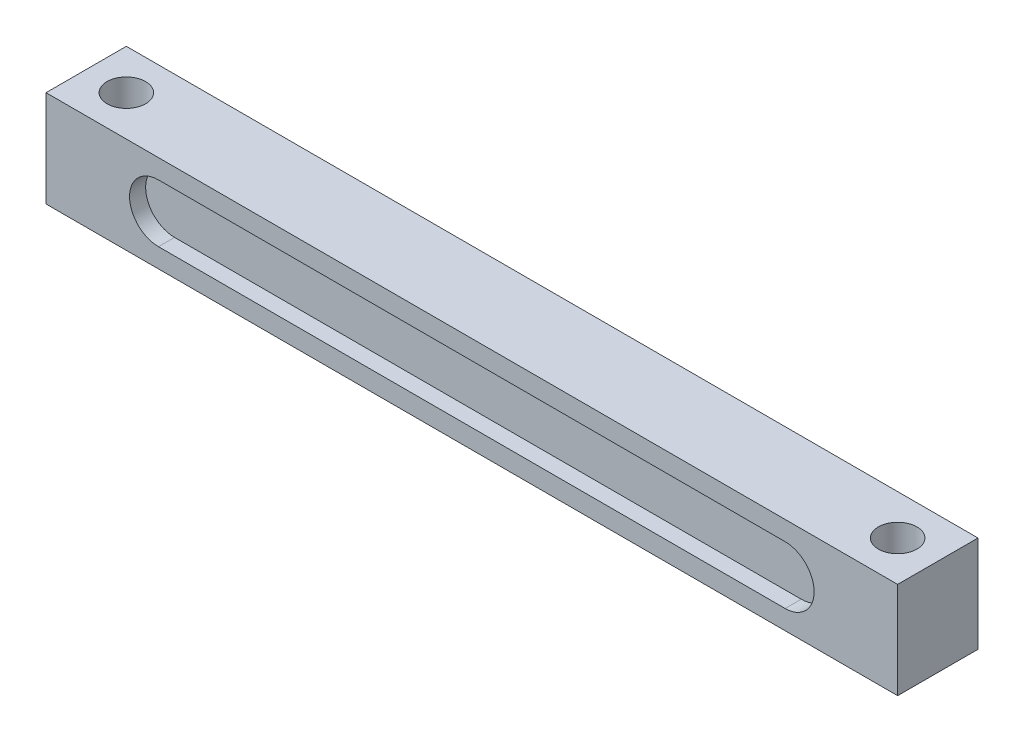
from build123d import *

# Parameters (mm, degrees)
SKETCH1_W           = 336.55
SKETCH1_H           = 31.75
SKETCH1_R           = 7.62
BOSS_EXTRUDE1_DEPTH = 38.1
CUT_EXTRUDE1_DEPTH  = 6.35
CUT_EXTRUDE3_START  = -6.35
CUT_EXTRUDE3_DEPTH  = 6.35


with BuildPart() as part:
    # Sketch1 → Boss-Extrude1 (new body)
    with BuildSketch(Plane(origin=(0, 0, 0), x_dir=(1, 0, 0), z_dir=(0, 1, 0))):
        with Locations((168.275, 15.875)):
            Rectangle(SKETCH1_W, SKETCH1_H)
        with Locations(Location((15.875, 15.875, 0), (0, 0, 90))):
            Circle(SKETCH1_R, mode=Mode.SUBTRACT)
        with Locations(Location((320.675, 15.875, 0), (0, 0, 90))):
            Circle(SKETCH1_R, mode=Mode.SUBTRACT)
    extrude(amount=BOSS_EXTRUDE1_DEPTH)

    # Sketch4 → Cut-Extrude1 (cut)
    with BuildSketch(Plane.XY):
        with BuildLine():
            Line((44.45, 30.48), (292.1, 30.48))
            ThreePointArc((292.1, 30.48), (303.53, 19.05), (292.1, 7.62))
            Line((292.1, 7.62), (44.45, 7.62))
            ThreePointArc((44.45, 7.62), (33.02, 19.05), (44.45, 30.48))
        make_face()
    extrude(amount=-CUT_EXTRUDE1_DEPTH, mode=Mode.SUBTRACT)

    # Sketch6 → Cut-Extrude3 (cut)
    with BuildSketch(Plane(origin=(0, 0, -31.75), x_dir=(-1, 0, 0), z_dir=(0, 0, -1)).offset(CUT_EXTRUDE3_START)):
        with BuildLine():
            Line((-292.1, 30.48), (-44.45, 30.48))
            ThreePointArc((-44.45, 30.48), (-33.02, 19.05), (-44.45, 7.62))
            Line((-44.45, 7.62), (-292.1, 7.62))
            ThreePointArc((-292.1, 7.62), (-303.53, 19.05), (-292.1, 30.48))
        make_face()
    extrude(amount=CUT_EXTRUDE3_DEPTH, mode=Mode.SUBTRACT)


solid = part.part
